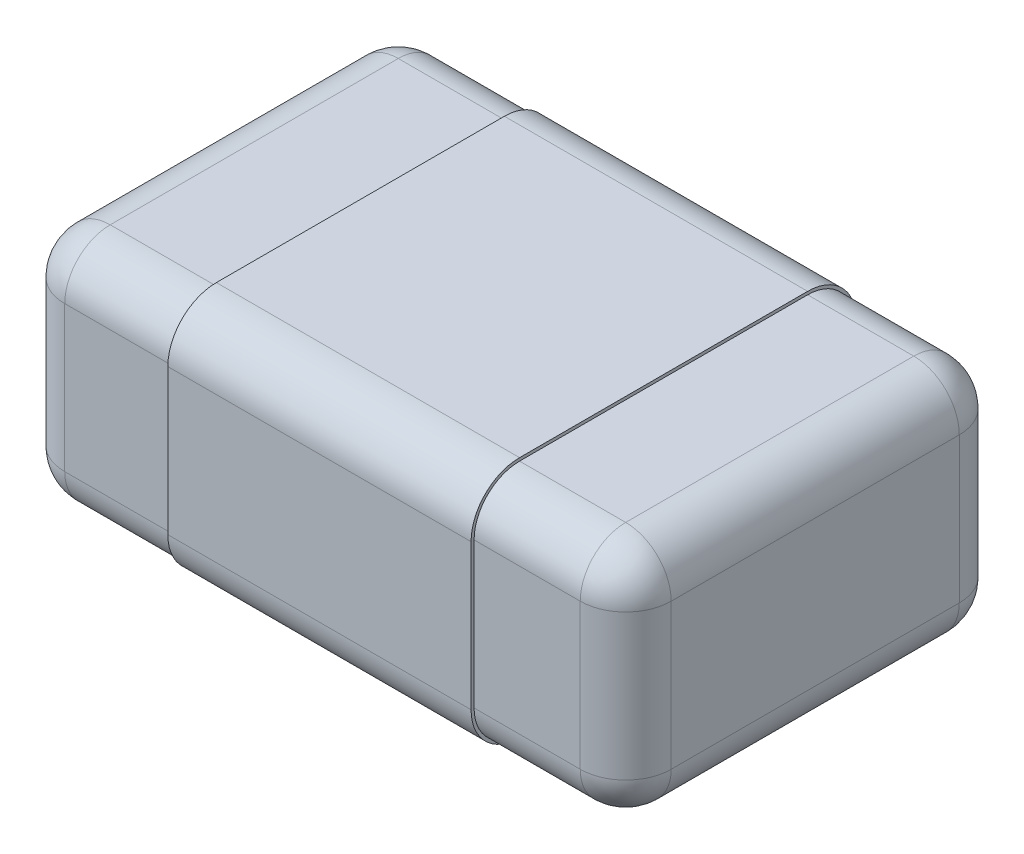
from build123d import *

# Parameters (mm, degrees)
ESBO_O1_W                     = 2
ESBO_O1_H                     = 1.25
RESSALTO_EXTRUS_O1_DEPTH      = 0.78
FILETE1_R                     = 0.15
RESSALTO_EXTRUS_O4_DEPTH      = 0.5
RESSALTO_EXTRUS_O4_DEPTH_BACK = 0.5
RESSALTO_EXTRUS_O5_DEPTH      = 0.02


with BuildPart() as part:
    # Esboço1 → Ressalto-extrusão1 (new body)
    with BuildSketch(Plane(origin=(0, 0, 0), x_dir=(1, 0, 0), z_dir=(0, 1, 0))):
        Rectangle(ESBO_O1_W, ESBO_O1_H)
    extrude(amount=-RESSALTO_EXTRUS_O1_DEPTH)

    # Filete1
    filete1_edges = [part.edges().sort_by_distance(p)[0] for p in [
        (1, -0.78, 0),
        (0, -0.78, -0.625),
        (-1, -0.78, 0),
        (0, 0, -0.625),
        (1, 0, 0),
        (0, 0, 0.625),
        (-1, 0, 0),
        (0, -0.78, 0.625),
        (-1, -0.39, -0.625),
        (1, -0.39, -0.625),
        (1, -0.39, 0.625),
        (-1, -0.39, 0.625),
    ]]
    fillet(filete1_edges, radius=FILETE1_R)

    # Esboço4 → Ressalto-extrusão4 (add, two sides: drawn at the far end of the back side and taken through both)
    with BuildSketch(Plane(origin=(0, 0, 0), x_dir=(0, 0, -1), z_dir=(1, 0, 0)).offset(-RESSALTO_EXTRUS_O4_DEPTH_BACK)):
        with BuildLine():
            Line((0.635, -0.63), (0.635, -0.15))
            ThreePointArc((0.635, -0.15), (0.588137085, -0.036862915), (0.475, 0.01))
            Line((0.475, 0.01), (-0.475, 0.01))
            ThreePointArc((-0.475, 0.01), (-0.588137085, -0.036862915), (-0.635, -0.15))
            Line((-0.635, -0.15), (-0.635, -0.63))
            ThreePointArc((-0.635, -0.63), (-0.588137085, -0.743137085), (-0.475, -0.79))
            Line((-0.475, -0.79), (0.475, -0.79))
            ThreePointArc((0.475, -0.79), (0.588137085, -0.743137085), (0.635, -0.63))
        make_face()
        with BuildLine():
            Line((0.625, -0.63), (0.625, -0.15))
            ThreePointArc((0.625, -0.15), (0.581066017, -0.043933983), (0.475, 0))
            Line((0.475, 0), (-0.475, 0))
            ThreePointArc((-0.475, 0), (-0.581066017, -0.043933983), (-0.625, -0.15))
            Line((-0.625, -0.15), (-0.625, -0.63))
            ThreePointArc((-0.625, -0.63), (-0.581066017, -0.736066017), (-0.475, -0.78))
            Line((-0.475, -0.78), (0.475, -0.78))
            ThreePointArc((0.475, -0.78), (0.581066017, -0.736066017), (0.625, -0.63))
        make_face(mode=Mode.SUBTRACT)
    extrude(amount=RESSALTO_EXTRUS_O4_DEPTH + RESSALTO_EXTRUS_O4_DEPTH_BACK)

    # Esboço2 → Ressalto-extrusão5 (add)
    # profile 1 of 3: a face of its own
    with BuildSketch(Plane(origin=(0, -0.79, 0), x_dir=(0, 0, 1), z_dir=(0, -1, 0))):
        with BuildLine():
            Line((0.240411447, -0.215189873), (0.240411447, -0.462025316))
            Line((0.240411447, -0.462025316), (0.158330751, -0.462025316))
            add(Edge.make_bspline(
                [(0.158330751, -0.462025316), (0.152214367, -0.456963441), (0.140208237, -0.447027254), (0.12230397, -0.432732049), (0.104986645, -0.419110313), (0.088088852, -0.406373508), (0.071638652, -0.394418598), (0.055729879, -0.383059249), (0.04010761, -0.372628254), (0.02977976, -0.365986606), (0.024727112, -0.362737342)],
                knots=[0, 0, 0, 0, 1.143871494, 2.245357909, 3.300914739, 4.318253735, 5.293884102, 6.230829319, 7.13447631, 8, 8, 8, 8], degree=3))
            add(Edge.make_bspline(
                [(0.024727112, -0.362737342), (0.018467772, -0.358883426), (0.00649251, -0.351510179), (-0.011299949, -0.341907859), (-0.027841839, -0.333863461), (-0.043428254, -0.327364414), (-0.058501424, -0.322335856), (-0.073657737, -0.319037953), (-0.088968207, -0.316848981), (-0.099276497, -0.316586719), (-0.104426369, -0.316455696)],
                knots=[0, 0, 0, 0, 1.267768508, 2.425473269, 3.486024264, 4.439590646, 5.336903618, 6.222592004, 7.112032784, 8, 8, 8, 8], degree=3))
            add(Edge.make_bspline(
                [(-0.104426369, -0.316455696), (-0.109973533, -0.31661856), (-0.120442742, -0.316925935), (-0.135183808, -0.319395248), (-0.147862366, -0.3238687), (-0.158544157, -0.329955464), (-0.16699737, -0.337794162), (-0.172986786, -0.347194623), (-0.176714501, -0.357985485), (-0.177106684, -0.365673027), (-0.177310072, -0.36965981)],
                knots=[0, 0, 0, 0, 1.306909451, 2.466541577, 3.505869428, 4.459795217, 5.344572835, 6.193571478, 7.063180651, 8, 8, 8, 8], degree=3))
            add(Edge.make_bspline(
                [(-0.177310072, -0.36965981), (-0.177088445, -0.373873366), (-0.176649647, -0.382215733), (-0.172906717, -0.394304114), (-0.167362161, -0.405870143), (-0.162961227, -0.413368033), (-0.160696148, -0.417227057)],
                knots=[0, 0, 0, 0, 0.988472559, 1.957064427, 2.948539211, 4, 4, 4, 4], degree=3))
            add(Edge.make_bspline(
                [(-0.160696148, -0.417227057), (-0.158162705, -0.420841831), (-0.153335217, -0.427729798), (-0.14551733, -0.436518088), (-0.138585493, -0.443311015), (-0.134646389, -0.447447152), (-0.133006275, -0.449169304)],
                knots=[0, 0, 0, 0, 1.249878488, 2.381649198, 3.326171657, 4, 4, 4, 4], degree=3))
            Line((-0.133006275, -0.449169304), (-0.133006275, -0.455696203))
            Line((-0.133006275, -0.455696203), (-0.241293458, -0.455696203))
            add(Edge.make_bspline(
                [(-0.241293458, -0.455696203), (-0.243030602, -0.452991868), (-0.246833272, -0.447071984), (-0.251734635, -0.436649009), (-0.256834934, -0.424293195), (-0.26197876, -0.410355035), (-0.266458759, -0.395520181), (-0.269739252, -0.380513709), (-0.271805277, -0.365794466), (-0.272101339, -0.356051915), (-0.272246781, -0.351265823)],
                knots=[0, 0, 0, 0, 0.69970136, 1.531670699, 2.504079761, 3.612943238, 4.767349377, 5.877514774, 6.957315063, 8, 8, 8, 8], degree=3))
            add(Edge.make_bspline(
                [(-0.272246781, -0.351265823), (-0.272145838, -0.346348053), (-0.271949257, -0.336770977), (-0.270052265, -0.322880358), (-0.266883874, -0.309923425), (-0.262513205, -0.297885305), (-0.2570145, -0.286673475), (-0.24997581, -0.276546396), (-0.241814993, -0.267285593), (-0.232475839, -0.258916878), (-0.221906303, -0.251655604), (-0.21043315, -0.245154857), (-0.197820463, -0.239860807), (-0.184283525, -0.23536637), (-0.169658558, -0.232092503), (-0.154107163, -0.2296073), (-0.137518514, -0.228111727), (-0.126119876, -0.227937721), (-0.120249154, -0.227848101)],
                knots=[0, 0, 0, 0, 1.059873424, 2.064042983, 3.015596836, 3.930697506, 4.820695307, 5.699957467, 6.581199529, 7.477193696, 8.396013015, 9.341094634, 10.315416404, 11.340324501, 12.412707035, 13.542640562, 14.734368785, 16, 16, 16, 16], degree=3))
            add(Edge.make_bspline(
                [(-0.120249154, -0.227848101), (-0.112856677, -0.228016187), (-0.098089689, -0.22835195), (-0.076109458, -0.23116239), (-0.054324675, -0.235452453), (-0.032644635, -0.241809914), (-0.010659972, -0.250133389), (0.01194365, -0.260654571), (0.035218138, -0.273724386), (0.050657644, -0.283701701), (0.058647207, -0.288864715)],
                knots=[0, 0, 0, 0, 0.92383478, 1.845424201, 2.765944236, 3.697111989, 4.666093288, 5.70224482, 6.810968485, 8, 8, 8, 8], degree=3))
            add(Edge.make_bspline(
                [(0.058647207, -0.288864715), (0.063540545, -0.292239236), (0.073096713, -0.298829317), (0.086879374, -0.3088528), (0.099855338, -0.318723297), (0.111778424, -0.328382753), (0.122497499, -0.33725099), (0.13166194, -0.344970557), (0.139184524, -0.351253132), (0.143567164, -0.355051598), (0.145474738, -0.356704905)],
                knots=[0, 0, 0, 0, 1.293836837, 2.526725554, 3.709287413, 4.842241028, 5.866627263, 6.737584004, 7.450524958, 8, 8, 8, 8], degree=3))
            Line((0.145474738, -0.356704905), (0.145474738, -0.215189873))
            Line((0.145474738, -0.215189873), (0.240411447, -0.215189873))
        make_face()
    # profile 2 of 3: a face of its own
    with BuildSketch(Plane(origin=(0, -0.79, 0), x_dir=(0, 0, 1), z_dir=(0, -1, 0))):
        with BuildLine():
            add(Edge.make_bspline(
                [(-0.00988523, 0.120886076), (0.00066438, 0.120777596), (0.021112324, 0.120567332), (0.050770501, 0.119340622), (0.078415824, 0.117074446), (0.10401909, 0.113930641), (0.127675305, 0.11001546), (0.149219582, 0.104722524), (0.168857978, 0.09868919), (0.180855217, 0.093374077), (0.186613979, 0.090822785)],
                knots=[0, 0, 0, 0, 1.264448795, 2.450837183, 3.556883169, 4.58795224, 5.542121969, 6.428511603, 7.245674236, 8, 8, 8, 8], degree=3))
            add(Edge.make_bspline(
                [(0.186613979, 0.090822785), (0.191832724, 0.088116676), (0.201962475, 0.082864032), (0.215475974, 0.073081294), (0.227068062, 0.062211939), (0.236600164, 0.050031826), (0.243987269, 0.036453455), (0.249411672, 0.021580295), (0.252443019, 0.005204892), (0.252855826, -0.006145441), (0.253069675, -0.012025316)],
                knots=[0, 0, 0, 0, 1.083268664, 2.102659247, 3.066213605, 4.006517345, 4.942721993, 5.906487414, 6.915486013, 8, 8, 8, 8], degree=3))
            add(Edge.make_bspline(
                [(0.253069675, -0.012025316), (0.252852783, -0.017871645), (0.252432967, -0.029187831), (0.249431014, -0.045506204), (0.243963122, -0.060330616), (0.236600695, -0.073883764), (0.227031616, -0.0861274), (0.215297585, -0.09703571), (0.201515042, -0.106829225), (0.191236688, -0.112131567), (0.185921732, -0.114873418)],
                knots=[0, 0, 0, 0, 1.07440951, 2.079632991, 3.034098871, 3.966800755, 4.903586396, 5.876505587, 6.901937131, 8, 8, 8, 8], degree=3))
            add(Edge.make_bspline(
                [(0.185921732, -0.114873418), (0.180129026, -0.117422161), (0.168091236, -0.122718691), (0.148460723, -0.128771479), (0.127002925, -0.134018254), (0.103578021, -0.138143353), (0.078175642, -0.141083229), (0.050772622, -0.143405159), (0.021276728, -0.144615824), (0.000927931, -0.144827376), (-0.009588553, -0.144936709)],
                knots=[0, 0, 0, 0, 0.761707614, 1.582900397, 2.469804074, 3.421542703, 4.445391707, 5.54897881, 6.73328501, 8, 8, 8, 8], degree=3))
            add(Edge.make_bspline(
                [(-0.009588553, -0.144936709), (-0.020369762, -0.144887229), (-0.041117875, -0.144792007), (-0.071028581, -0.143333759), (-0.098482372, -0.1412524), (-0.123614463, -0.13823957), (-0.146683241, -0.134109276), (-0.167944168, -0.128750561), (-0.187668818, -0.122481979), (-0.199867758, -0.117027457), (-0.205791085, -0.114378956)],
                knots=[0, 0, 0, 0, 1.292793539, 2.487942473, 3.590368342, 4.594084519, 5.522245339, 6.398581889, 7.222414246, 8, 8, 8, 8], degree=3))
            add(Edge.make_bspline(
                [(-0.205791085, -0.114378956), (-0.211110301, -0.111609007), (-0.221376966, -0.106262704), (-0.235073612, -0.096336734), (-0.246722638, -0.085334478), (-0.256127396, -0.072993755), (-0.263517384, -0.059482581), (-0.268421711, -0.044656959), (-0.271798667, -0.028757919), (-0.272094432, -0.017714037), (-0.272246781, -0.012025316)],
                knots=[0, 0, 0, 0, 1.109275554, 2.141022398, 3.121040764, 4.065986229, 5.002793741, 5.958326063, 6.948330593, 8, 8, 8, 8], degree=3))
            add(Edge.make_bspline(
                [(-0.272246781, -0.012025316), (-0.272046579, -0.006043877), (-0.271660816, 0.005481624), (-0.268470632, 0.021993085), (-0.263150324, 0.036960304), (-0.255454148, 0.050345773), (-0.245642566, 0.062390805), (-0.233819981, 0.0732678), (-0.219846704, 0.08298967), (-0.209487785, 0.0882761), (-0.204109914, 0.09102057)],
                knots=[0, 0, 0, 0, 1.090787275, 2.10181366, 3.055147114, 3.976595958, 4.904774509, 5.879576888, 6.899174391, 8, 8, 8, 8], degree=3))
            add(Edge.make_bspline(
                [(-0.204109914, 0.09102057), (-0.198282864, 0.093565617), (-0.186203782, 0.098841329), (-0.166564535, 0.104939577), (-0.145056829, 0.110083568), (-0.121581167, 0.114013891), (-0.096247041, 0.117211018), (-0.069048851, 0.119254133), (-0.040063859, 0.120736953), (-0.020139192, 0.120835408), (-0.00988523, 0.120886076)],
                knots=[0, 0, 0, 0, 0.770502262, 1.59719915, 2.489107463, 3.450471223, 4.48167079, 5.584362407, 6.7568247, 8, 8, 8, 8], degree=3))
        make_face()
        with BuildLine():
            add(Edge.make_bspline(
                [(-0.00988523, 0.032278481), (-0.017335235, 0.032224744), (-0.03164288, 0.032121543), (-0.052217355, 0.031779129), (-0.07104871, 0.031022732), (-0.088152315, 0.029776962), (-0.103569772, 0.028501522), (-0.117255137, 0.026701021), (-0.129212067, 0.024681932), (-0.139562429, 0.02231793), (-0.148443418, 0.019579571), (-0.156053558, 0.016386943), (-0.162575373, 0.012891542), (-0.167915103, 0.008780082), (-0.172136864, 0.004265744), (-0.175104817, -0.00076613), (-0.176997981, -0.00622262), (-0.177204629, -0.010064822), (-0.177310072, -0.012025316)],
                knots=[0, 0, 0, 0, 1.929100326, 3.704814234, 5.327997663, 6.808188623, 8.145079156, 9.332956936, 10.381192375, 11.283900527, 12.080268448, 12.784124463, 13.418341996, 13.990284721, 14.521958489, 15.007958048, 15.493807677, 16, 16, 16, 16], degree=3))
            add(Edge.make_bspline(
                [(-0.177310072, -0.012025316), (-0.177201487, -0.013952383), (-0.176986902, -0.017760626), (-0.175104835, -0.023185486), (-0.172136995, -0.028217841), (-0.167914478, -0.032730347), (-0.162578032, -0.036849502), (-0.156030446, -0.040317584), (-0.148470728, -0.043661172), (-0.139557656, -0.046357536), (-0.129213554, -0.048735481), (-0.117222845, -0.050759578), (-0.103502855, -0.052543669), (-0.088020951, -0.053833617), (-0.0708179, -0.05507521), (-0.051854642, -0.055827566), (-0.031148424, -0.056172575), (-0.016774848, -0.05627552), (-0.009291876, -0.056329114)],
                knots=[0, 0, 0, 0, 0.496275509, 0.980733238, 1.465340469, 1.995491057, 2.565795237, 3.198195815, 3.903381773, 4.697468199, 5.597590203, 6.642822578, 7.835737307, 9.168797815, 10.653238981, 12.288779388, 14.067915585, 16, 16, 16, 16], degree=3))
            add(Edge.make_bspline(
                [(-0.009291876, -0.056329114), (-0.001973728, -0.056275178), (0.012136138, -0.056171186), (0.03247988, -0.05582839), (0.051179383, -0.055073158), (0.068184397, -0.053829711), (0.083534738, -0.052544366), (0.097188903, -0.050756791), (0.109205617, -0.048707271), (0.119659211, -0.04637592), (0.128722094, -0.043638718), (0.136452147, -0.040314019), (0.143172519, -0.036869708), (0.148638271, -0.03276527), (0.152840617, -0.028184778), (0.155947608, -0.023217447), (0.157803261, -0.017756603), (0.158022185, -0.013951031), (0.158132966, -0.012025316)],
                knots=[0, 0, 0, 0, 1.896767928, 3.657092201, 5.27328851, 6.746368892, 8.076025924, 9.26503724, 10.314272961, 11.23449221, 12.039773993, 12.763366423, 13.413189726, 13.992459479, 14.524640598, 15.015510453, 15.501823705, 16, 16, 16, 16], degree=3))
            add(Edge.make_bspline(
                [(0.158132966, -0.012025316), (0.15802208, -0.010099752), (0.15780295, -0.006294478), (0.155948822, -0.000831439), (0.152835849, 0.004127284), (0.148671843, 0.008728943), (0.143106752, 0.012682069), (0.136512584, 0.016318615), (0.128687955, 0.01944403), (0.119667636, 0.022250216), (0.109191238, 0.024514546), (0.097179523, 0.026795554), (0.083416992, 0.028298466), (0.068000477, 0.029876176), (0.050905713, 0.030829761), (0.032154994, 0.031837726), (0.011706673, 0.032104279), (-0.002501472, 0.032218909), (-0.00988523, 0.032278481)],
                knots=[0, 0, 0, 0, 0.496691071, 0.981554468, 1.470960882, 2.001555398, 2.573987342, 3.225948283, 3.944107278, 4.746988257, 5.664464036, 6.712061857, 7.904911462, 9.239876577, 10.716497891, 12.328258503, 14.091851269, 16, 16, 16, 16], degree=3))
        make_face(mode=Mode.SUBTRACT)
    # profile 3 of 3: a face of its own
    with BuildSketch(Plane(origin=(0, -0.79, 0), x_dir=(0, 0, 1), z_dir=(0, -1, 0))):
        with BuildLine():
            add(Edge.make_bspline(
                [(0.091083915, 0.450632911), (0.097053447, 0.450509358), (0.108785804, 0.450266531), (0.125962302, 0.448646824), (0.142305783, 0.445603054), (0.157799263, 0.44161447), (0.172377919, 0.436489934), (0.185869221, 0.430263312), (0.198287496, 0.422964234), (0.205694588, 0.417127981), (0.209359232, 0.414240506)],
                knots=[0, 0, 0, 0, 1.134951389, 2.230602796, 3.275446553, 4.29236384, 5.269554879, 6.208874539, 7.113844281, 8, 8, 8, 8], degree=3))
            add(Edge.make_bspline(
                [(0.209359232, 0.414240506), (0.2127705, 0.411189439), (0.219533431, 0.405140616), (0.228167833, 0.394717509), (0.23582354, 0.383703866), (0.242077724, 0.371707746), (0.247123043, 0.358665047), (0.25063184, 0.344347483), (0.252704345, 0.32872668), (0.25294503, 0.317892958), (0.253069675, 0.312282437)],
                knots=[0, 0, 0, 0, 0.955266016, 1.893840718, 2.820634586, 3.754367388, 4.713946363, 5.736548792, 6.827813699, 8, 8, 8, 8], degree=3))
            add(Edge.make_bspline(
                [(0.253069675, 0.312282437), (0.252962149, 0.305883194), (0.252754409, 0.293519747), (0.250987221, 0.275656885), (0.247970503, 0.259169723), (0.243671666, 0.244172636), (0.23869952, 0.230568383), (0.233326183, 0.218330164), (0.227914993, 0.207265708), (0.223722107, 0.20063384), (0.221720782, 0.197468354)],
                knots=[0, 0, 0, 0, 1.271933853, 2.45739788, 3.56403977, 4.599221435, 5.554937142, 6.441247417, 7.255985077, 8, 8, 8, 8], degree=3))
            Line((0.221720782, 0.197468354), (0.113829169, 0.197468354))
            Line((0.113829169, 0.197468354), (0.113829169, 0.205874209))
            add(Edge.make_bspline(
                [(0.113829169, 0.205874209), (0.116773443, 0.209066417), (0.122695825, 0.215487517), (0.130869901, 0.225919795), (0.138193223, 0.237268836), (0.145102081, 0.248979277), (0.150773289, 0.260947818), (0.154979882, 0.272618529), (0.157655172, 0.283812355), (0.157977308, 0.291139201), (0.158132966, 0.294679589)],
                knots=[0, 0, 0, 0, 1.028515649, 2.068850487, 3.134434502, 4.226024606, 5.287939915, 6.266010027, 7.162122652, 8, 8, 8, 8], degree=3))
            add(Edge.make_bspline(
                [(0.158132966, 0.294679589), (0.157967363, 0.298909235), (0.157619397, 0.307796623), (0.155525141, 0.318921878), (0.153055031, 0.328005688), (0.149838156, 0.334308479), (0.14592635, 0.340209222), (0.142479798, 0.343461546), (0.140727903, 0.345114715)],
                knots=[0, 0, 0, 0, 1.383822774, 2.907706505, 3.696267359, 4.453880301, 5.214101212, 6, 6, 6, 6], degree=3))
            add(Edge.make_bspline(
                [(0.140727903, 0.345114715), (0.137650114, 0.347558836), (0.131257704, 0.352635149), (0.121545824, 0.356910215), (0.112632122, 0.359733982), (0.104401993, 0.360968757), (0.094929568, 0.361895895), (0.088153276, 0.361980445), (0.084557017, 0.362025316)],
                knots=[0, 0, 0, 0, 1.17336722, 2.437023599, 3.149324183, 3.970868836, 4.92311568, 6, 6, 6, 6], degree=3))
            add(Edge.make_bspline(
                [(0.084557017, 0.362025316), (0.081027018, 0.361955452), (0.074372913, 0.361823756), (0.065002919, 0.360702671), (0.056936311, 0.358631198), (0.050052002, 0.355875338), (0.044329839, 0.352346183), (0.039527085, 0.348302991), (0.035324556, 0.343888435), (0.033332401, 0.34041422), (0.032341827, 0.338686709)],
                knots=[0, 0, 0, 0, 1.405388907, 2.649180623, 3.747479513, 4.712702894, 5.590628025, 6.410723464, 7.209751833, 8, 8, 8, 8], degree=3))
            add(Edge.make_bspline(
                [(0.032341827, 0.338686709), (0.03142998, 0.336863083), (0.029574546, 0.333152355), (0.027770405, 0.327028188), (0.026453486, 0.320442524), (0.025676926, 0.311242073), (0.025409984, 0.300187215), (0.0252816, 0.291515122), (0.025221574, 0.287460443)],
                knots=[0, 0, 0, 0, 0.701148582, 1.426703207, 2.190614458, 3.012117132, 4.603000887, 6, 6, 6, 6], degree=3))
            Line((0.025221574, 0.287460443), (0.025221574, 0.273417722))
            Line((0.025221574, 0.273417722), (-0.063386021, 0.273417722))
            Line((-0.063386021, 0.273417722), (-0.063386021, 0.286669304))
            add(Edge.make_bspline(
                [(-0.063386021, 0.286669304), (-0.063455272, 0.291589096), (-0.063587726, 0.300999093), (-0.065283585, 0.314379314), (-0.068038724, 0.326548177), (-0.072048081, 0.333352491), (-0.073967509, 0.336609968)],
                knots=[0, 0, 0, 0, 1.139338921, 2.179193021, 3.128312282, 4, 4, 4, 4], degree=3))
            add(Edge.make_bspline(
                [(-0.073967509, 0.336609968), (-0.075144604, 0.338067341), (-0.077528059, 0.341018318), (-0.081972659, 0.3447793), (-0.087045131, 0.348023411), (-0.092781122, 0.350879523), (-0.099410871, 0.353029019), (-0.107036227, 0.354586808), (-0.115707438, 0.355573854), (-0.121861529, 0.355654062), (-0.125094882, 0.355696203)],
                knots=[0, 0, 0, 0, 0.792054515, 1.603800977, 2.451955997, 3.338654888, 4.310024996, 5.394433015, 6.631037583, 8, 8, 8, 8], degree=3))
            add(Edge.make_bspline(
                [(-0.125094882, 0.355696203), (-0.127636319, 0.355646326), (-0.132472698, 0.355551411), (-0.139363003, 0.354651034), (-0.145554029, 0.353210268), (-0.152540212, 0.350499658), (-0.160016751, 0.346296122), (-0.164576318, 0.341597066), (-0.166728585, 0.339378956)],
                knots=[0, 0, 0, 0, 0.989765321, 1.883532761, 2.702857336, 3.459039476, 4.800582506, 6, 6, 6, 6], degree=3))
            add(Edge.make_bspline(
                [(-0.166728585, 0.339378956), (-0.168629059, 0.336520165), (-0.172496417, 0.330702685), (-0.175401011, 0.320710601), (-0.176946736, 0.311148559), (-0.177196151, 0.305002588), (-0.177310072, 0.302195411)],
                knots=[0, 0, 0, 0, 1.043133073, 2.122717367, 3.142549896, 4, 4, 4, 4], degree=3))
            add(Edge.make_bspline(
                [(-0.177310072, 0.302195411), (-0.17706029, 0.298020075), (-0.176549144, 0.28947581), (-0.172961809, 0.276812285), (-0.167689707, 0.264345965), (-0.163303624, 0.256308201), (-0.161091718, 0.252254747)],
                knots=[0, 0, 0, 0, 0.943448275, 1.930640289, 2.956419505, 4, 4, 4, 4], degree=3))
            add(Edge.make_bspline(
                [(-0.161091718, 0.252254747), (-0.159009143, 0.249014008), (-0.154592346, 0.242140936), (-0.147988434, 0.234195188), (-0.142547416, 0.227951297), (-0.138771149, 0.223901281), (-0.135817999, 0.220310799), (-0.133873197, 0.218259931), (-0.133006275, 0.217345728)],
                knots=[0, 0, 0, 0, 1.543909965, 3.274378284, 4.136373371, 4.866604337, 5.494772765, 6, 6, 6, 6], degree=3))
            Line((-0.133006275, 0.217345728), (-0.133006275, 0.210126582))
            Line((-0.133006275, 0.210126582), (-0.240601211, 0.210126582))
            add(Edge.make_bspline(
                [(-0.240601211, 0.210126582), (-0.242450585, 0.213303994), (-0.246369384, 0.220036887), (-0.251809205, 0.23114714), (-0.25692918, 0.243865818), (-0.262215608, 0.257716956), (-0.26656988, 0.27251795), (-0.269916096, 0.2877018), (-0.271795048, 0.303104175), (-0.272095885, 0.313431485), (-0.272246781, 0.318611551)],
                knots=[0, 0, 0, 0, 0.771891608, 1.635628057, 2.594636255, 3.650327867, 4.747660996, 5.83112928, 6.912118025, 8, 8, 8, 8], degree=3))
            add(Edge.make_bspline(
                [(-0.272246781, 0.318611551), (-0.272162928, 0.323527912), (-0.272000999, 0.333021924), (-0.270450242, 0.346734122), (-0.26817752, 0.359473677), (-0.264691988, 0.371234892), (-0.260176084, 0.382048398), (-0.254988939, 0.392133686), (-0.248714576, 0.401286718), (-0.243888001, 0.40677054), (-0.241491243, 0.409493671)],
                knots=[0, 0, 0, 0, 1.199045861, 2.315484163, 3.362897413, 4.352810628, 5.301242744, 6.218611169, 7.11540602, 8, 8, 8, 8], degree=3))
            add(Edge.make_bspline(
                [(-0.241491243, 0.409493671), (-0.238696899, 0.412313667), (-0.233108984, 0.417952879), (-0.22327782, 0.424990816), (-0.212499908, 0.43108311), (-0.200543554, 0.435818114), (-0.187767102, 0.439761209), (-0.174090153, 0.442290823), (-0.15968961, 0.444099424), (-0.149824126, 0.444234605), (-0.144774471, 0.444303797)],
                knots=[0, 0, 0, 0, 0.899477092, 1.798705297, 2.733090891, 3.702715351, 4.710848355, 5.762743087, 6.854858352, 8, 8, 8, 8], degree=3))
            add(Edge.make_bspline(
                [(-0.144774471, 0.444303797), (-0.13774026, 0.44410545), (-0.124053298, 0.443719512), (-0.104205466, 0.440419218), (-0.085723176, 0.434865413), (-0.071472445, 0.428381022), (-0.060961816, 0.422356634), (-0.053920927, 0.417330456), (-0.047479686, 0.412149259), (-0.041765251, 0.406592552), (-0.036904716, 0.400565547), (-0.032634834, 0.394283254), (-0.029107381, 0.387581547), (-0.027371347, 0.382880184), (-0.026499154, 0.380518196)],
                knots=[0, 0, 0, 0, 1.770401226, 3.444794915, 5.049233062, 6.61689752, 7.37571781, 8.096540093, 8.792709469, 9.455985318, 10.099006896, 10.739021174, 11.366478004, 12, 12, 12, 12], degree=3))
            Line((-0.026499154, 0.380518196), (-0.021752319, 0.380518196))
            add(Edge.make_bspline(
                [(-0.021752319, 0.380518196), (-0.020681286, 0.384576743), (-0.018514064, 0.392789164), (-0.013959303, 0.402638269), (-0.008981778, 0.410192744), (-0.004345557, 0.415989843), (0.001501742, 0.421512344), (0.005845282, 0.424986086), (0.008113188, 0.426799842)],
                knots=[0, 0, 0, 0, 1.338731653, 2.708907517, 3.438678351, 4.224363953, 5.072881742, 6, 6, 6, 6], degree=3))
            add(Edge.make_bspline(
                [(0.008113188, 0.426799842), (0.010417283, 0.428504318), (0.015179942, 0.432027539), (0.023289496, 0.436373299), (0.032211654, 0.440482325), (0.042109731, 0.443996484), (0.052959889, 0.447020881), (0.064808968, 0.449142306), (0.077637915, 0.450450203), (0.086498549, 0.450570604), (0.091083915, 0.450632911)],
                knots=[0, 0, 0, 0, 0.781940693, 1.616303212, 2.506838174, 3.463859656, 4.481845554, 5.580393902, 6.747857106, 8, 8, 8, 8], degree=3))
        make_face()
    extrude(amount=RESSALTO_EXTRUS_O5_DEPTH)


solid = part.part
